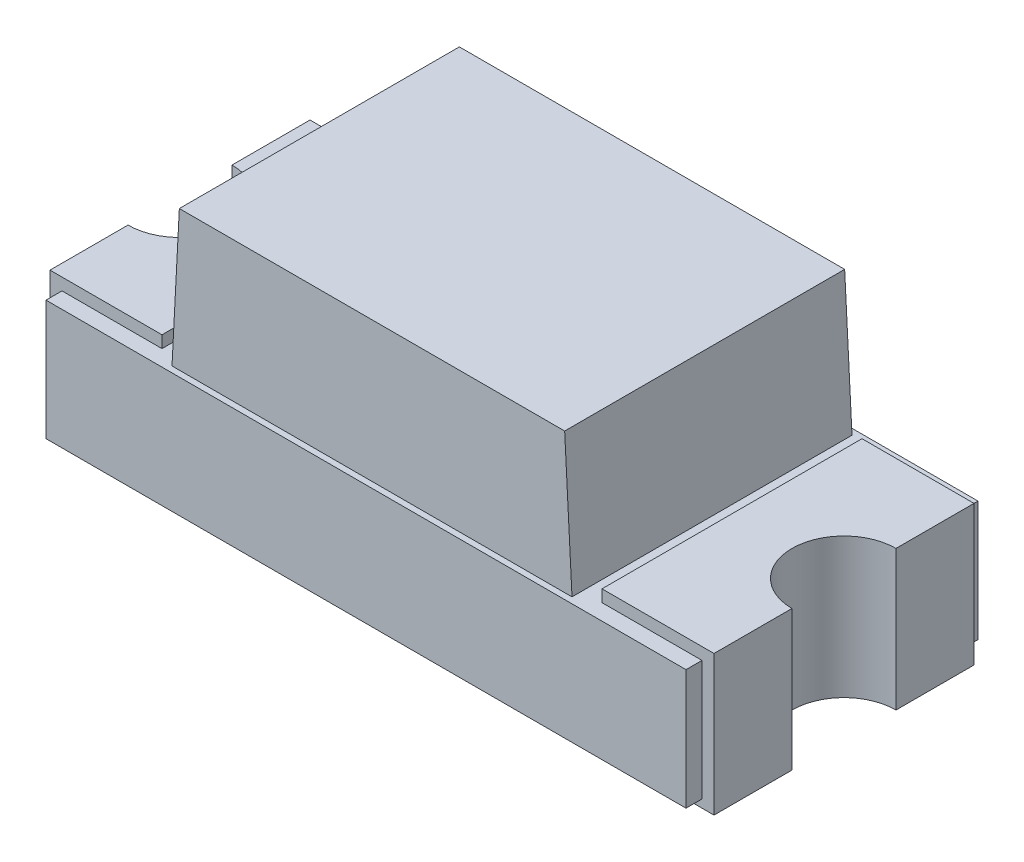
from build123d import *

# Parameters (mm, degrees)
SKETCH_1_W          = 1.6
SKETCH_1_H          = 0.73
EXTRUDE_1_DEPTH     = 0.15
SKETCH_2_W          = 0.28
SKETCH_2_H          = 0.65
EXTRUDE_2_DEPTH     = 0.35
SKETCH_4_R          = 0.13
CUT_EXTRUDE_1_DEPTH = 0.5
SKETCH_5_W          = 1
SKETCH_5_H          = 0.7
EXTRUDE_3_DEPTH     = 0.35
DRAFT_1_ANGLE       = 3


with BuildPart() as part:
    # 草图1 → 凸台-拉伸1 (new, symmetric)
    with BuildSketch(Plane(origin=(0, 0, 0), x_dir=(1, 0, 0), z_dir=(0, 1, 0))):
        Rectangle(SKETCH_1_W, SKETCH_1_H)
    extrude(amount=EXTRUDE_1_DEPTH, both=True)

    # 草图2 → 凸台-拉伸2 (add)
    with BuildSketch(Plane(origin=(0, 0.18, 0), x_dir=(1, 0, 0), z_dir=(0, 1, 0))):
        with Locations((-0.69, 0)):
            Rectangle(SKETCH_2_W, SKETCH_2_H)
    extrude_2 = extrude(amount=-EXTRUDE_2_DEPTH)

    # 草图4 → 切除-拉伸1 (cut, symmetric)
    with BuildSketch(Plane(origin=(0, 0, 0), x_dir=(1, 0, 0), z_dir=(0, 1, 0))):
        with Locations((-0.83, 0)):
            Circle(SKETCH_4_R)
    cut_extrude_1 = extrude(amount=CUT_EXTRUDE_1_DEPTH, both=True, mode=Mode.SUBTRACT)

    # 镜向1: 凸台-拉伸2, 切除-拉伸1 across plane
    add(extrude_2.mirror(Plane(origin=(0, 0, 0), x_dir=(0, 0, 1), z_dir=(1, 0, 0))))
    add(cut_extrude_1.mirror(Plane(origin=(0, 0, 0), x_dir=(0, 0, 1), z_dir=(1, 0, 0))), mode=Mode.SUBTRACT)

    # 草图5 → 凸台-拉伸3 (add)
    with BuildSketch(Plane(origin=(0, 0.15, 0), x_dir=(1, 0, 0), z_dir=(0, 1, 0))):
        Rectangle(SKETCH_5_W, SKETCH_5_H)
    extrude(amount=EXTRUDE_3_DEPTH)

    # 拔模1
    draft_1_faces = [part.faces().sort_by_distance(p)[0] for p in [
        (0.5, 0.325, 0),
        (-0.5, 0.325, 0),
    ]]
    draft(draft_1_faces, Plane.ZX.offset(0.15), DRAFT_1_ANGLE)


solid = part.part
